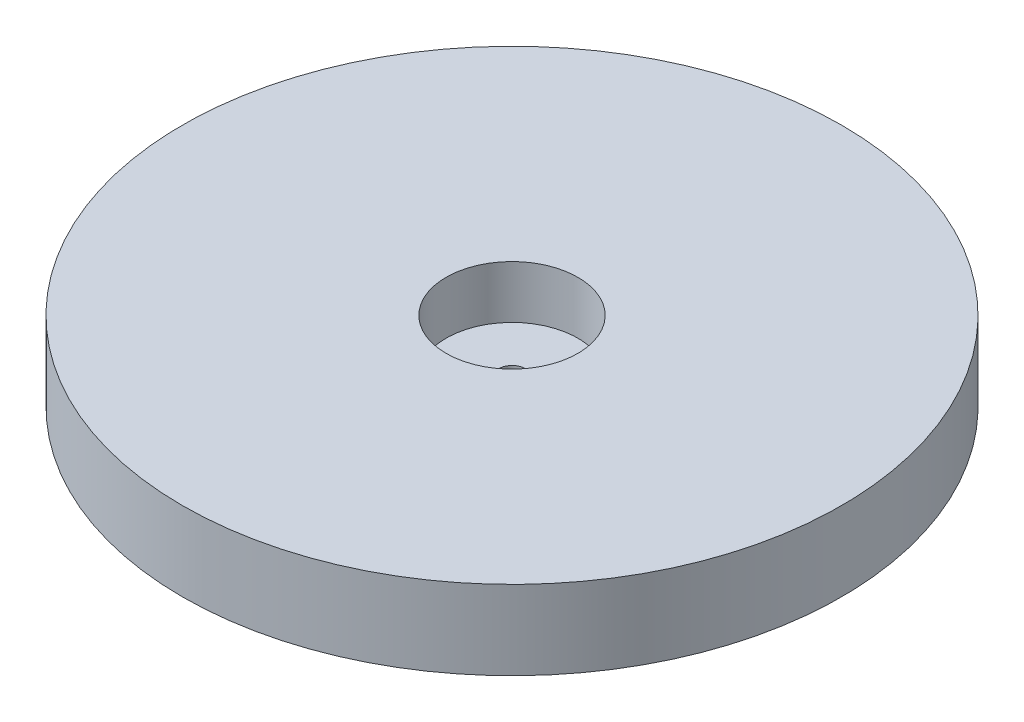
from build123d import *

# Parameters (mm, degrees)
ESQUISSE1_R             = 50
BOSS_EXTRU_1_DEPTH      = 12
ESQUISSE2_R             = 10
ENL_V_MAT_EXTRU_1_DEPTH = 8
ESQUISSE4_R             = 2
ENL_V_MAT_EXTRU_4_DEPTH = 12


with BuildPart() as part:
    # Esquisse1 → Boss.-Extru.1 (new body)
    with BuildSketch(Plane(origin=(0, 0, 0), x_dir=(1, 0, 0), z_dir=(0, 1, 0))):
        with Locations(Location((0, 0, 0), (0, 0, 270))):
            Circle(ESQUISSE1_R)
    extrude(amount=BOSS_EXTRU_1_DEPTH)

    # Esquisse2 → Enlèv. mat.-Extru.1 (cut)
    with BuildSketch(Plane(origin=(0, 12, 0), x_dir=(1, 0, 0), z_dir=(0, 1, 0))):
        with Locations(Location((0, 0, 0), (0, 0, 270))):
            Circle(ESQUISSE2_R)
    extrude(amount=-ENL_V_MAT_EXTRU_1_DEPTH, mode=Mode.SUBTRACT)

    # Esquisse4 → Enlèv. mat.-Extru.4 (cut)
    with BuildSketch(Plane(origin=(0, 12, 0), x_dir=(1, 0, 0), z_dir=(0, 1, 0))):
        with Locations(Location((0, 0, 0), (0, 0, 270))):
            Circle(ESQUISSE4_R)
    extrude(amount=-ENL_V_MAT_EXTRU_4_DEPTH, mode=Mode.SUBTRACT)


solid = part.part
